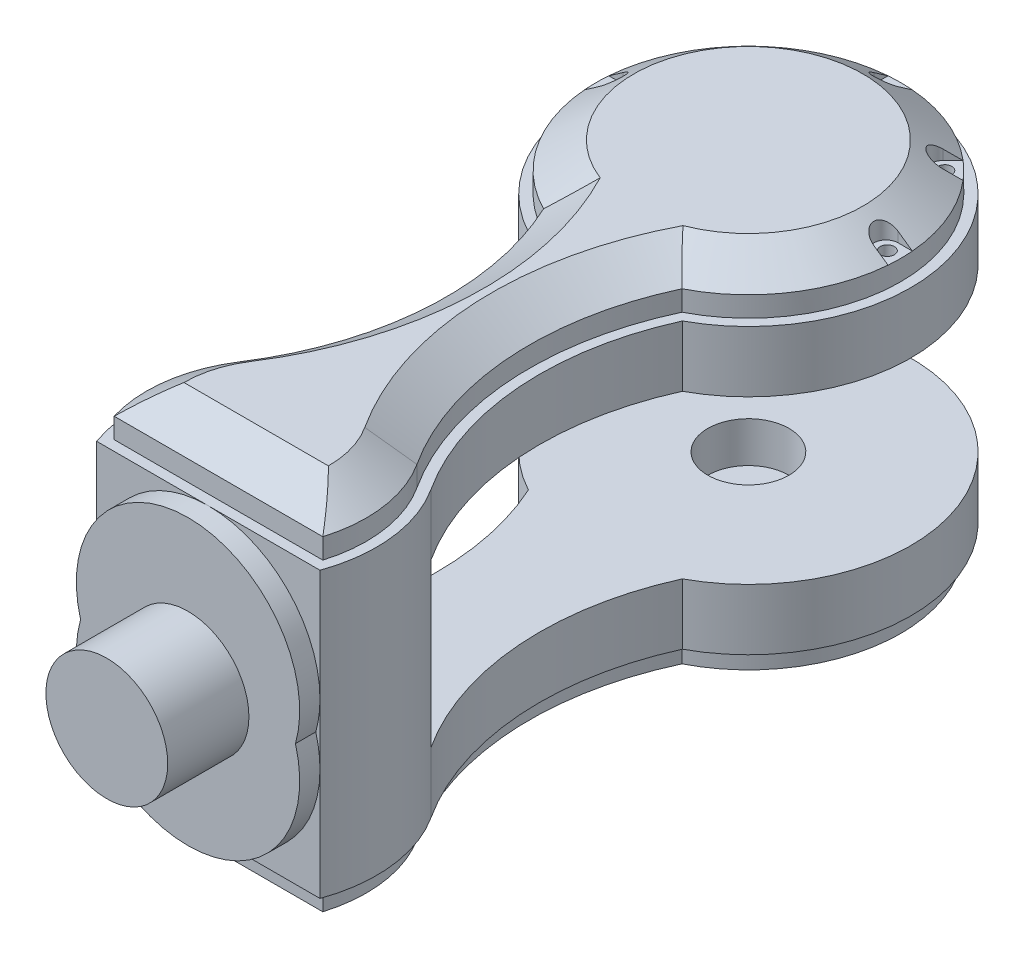
from build123d import *

# Parameters (mm, degrees)
SKETCH1_R                       = 27.5
BOSS_EXTRUDE1_DEPTH             = 5
BOSS_EXTRUDE2_DEPTH             = 15
BOSS_EXTRUDE3_DEPTH             = 1
BOSS_EXTRUDE4_DEPTH             = 4
BOSS_EXTRUDE5_DEPTH             = 6.5
BOSS_EXTRUDE5_DRAFT             = 55
CUT_EXTRUDE1_DEPTH              = 6.5
SKETCH13_R                      = 1.75
CUT_EXTRUDE8_DEPTH              = 5
CIRPATTERN1_COUNT               = 3
CIRPATTERN1_ANGLE               = 90
CIRPATTERN1_THE_OTHER_WAY_COUNT = 3
CIRPATTERN1_THE_OTHER_WAY_ANGLE = 90
BOSS_EXTRUDE6_DEPTH             = 40
SKETCH15_R                      = 15
BOSS_EXTRUDE7_DEPTH             = 20
SKETCH16_R                      = 10
CUT_EXTRUDE9_DEPTH              = 10
SCALE1_SCALE                    = 25.398779841


with BuildPart() as part:
    # Sketch1 → Boss-Extrude1 (new body)
    with BuildSketch(Plane.XY):
        Circle(SKETCH1_R)
    extrude(amount=BOSS_EXTRUDE1_DEPTH)



with BuildPart() as body_2:
    # Sketch3 → Boss-Extrude2 (new body)
    with BuildSketch(Plane(origin=(0, 27.5, 0), x_dir=(1, 0, 0), z_dir=(0, 1, 0))):
        with BuildLine():
            Line((-27.5, 0), (27.5, 0))
            ThreePointArc((27.5, 0), (29.34132241, 15.851086169), (23.954515433, 30.872061887))
            ThreePointArc((23.954515433, 30.872061887), (12.91820016, 63.687281567), (18.957742195, 97.777790943))
            ThreePointArc((18.957742195, 97.777790943), (0, 173), (-18.957742195, 97.777790943))
            ThreePointArc((-18.957742195, 97.777790943), (-12.91820016, 63.687281567), (-23.954515433, 30.872061887))
            ThreePointArc((-23.954515433, 30.872061887), (-29.34132241, 15.851086169), (-27.5, 0))
        make_face()
    extrude(amount=BOSS_EXTRUDE2_DEPTH)

    # Sketch5 → Boss-Extrude3 (add)
    with BuildSketch(Plane(origin=(0, 42.5, 0), x_dir=(1, 0, 0), z_dir=(0, 1, 0))):
        with BuildLine():
            Line((-25.693531989, 2.5), (25.693531989, 2.5))
            ThreePointArc((25.693531989, 2.5), (26.746761603, 16.429214372), (21.855612604, 29.513898821))
            ThreePointArc((21.855612604, 29.513898821), (10.394163023, 63.933295532), (17.042604151, 99.596412711))
            ThreePointArc((17.042604151, 99.596412711), (0, 170.5), (-17.042604151, 99.596412711))
            ThreePointArc((-17.042604151, 99.596412711), (-10.394163023, 63.933295532), (-21.855612604, 29.513898821))
            ThreePointArc((-21.855612604, 29.513898821), (-26.746761603, 16.429214372), (-25.693531989, 2.5))
        make_face()
    extrude(amount=BOSS_EXTRUDE3_DEPTH)

    # Sketch9 → Boss-Extrude4 (add)
    with BuildSketch(Plane(origin=(0, 43.5, 0), x_dir=(1, 0, 0), z_dir=(0, 1, 0))):
        with BuildLine():
            ThreePointArc((17.042604151, 99.596412711), (0, 170.5), (-17.042604151, 99.596412711))
            ThreePointArc((-17.042604151, 99.596412711), (-10.394163023, 63.933295532), (-21.855612604, 29.513898821))
            ThreePointArc((-21.855612604, 29.513898821), (-26.746761603, 16.429214372), (-25.693531989, 2.5))
            Line((-25.693531989, 2.5), (25.693531989, 2.5))
            ThreePointArc((25.693531989, 2.5), (26.746761603, 16.429214372), (21.855612604, 29.513898821))
            ThreePointArc((21.855612604, 29.513898821), (10.394163023, 63.933295532), (17.042604151, 99.596412711))
        make_face()
    extrude(amount=BOSS_EXTRUDE4_DEPTH)


with BuildPart() as boss_extrude5_tool:
    # Sketch10 → Boss-Extrude5 (with draft: the straight prism first)
    with BuildSketch(Plane(origin=(0, 47.5, 0), x_dir=(1, 0, 0), z_dir=(0, 1, 0))):
        with BuildLine():
            Line((-25.693531989, 2.5), (25.693531989, 2.5))
            ThreePointArc((25.693531989, 2.5), (26.746761603, 16.429214372), (21.855612604, 29.513898821))
            ThreePointArc((21.855612604, 29.513898821), (10.394163023, 63.933295532), (17.042604151, 99.596412711))
            ThreePointArc((17.042604151, 99.596412711), (0, 170.5), (-17.042604151, 99.596412711))
            ThreePointArc((-17.042604151, 99.596412711), (-10.394163023, 63.933295532), (-21.855612604, 29.513898821))
            ThreePointArc((-21.855612604, 29.513898821), (-26.746761603, 16.429214372), (-25.693531989, 2.5))
        make_face()
    extrude(amount=BOSS_EXTRUDE5_DEPTH)
    # Boss-Extrude5: the draft: its side faces are tilted about the plane it starts from
    boss_extrude5_sides = [boss_extrude5_tool.faces().sort_by_distance(p)[0] for p in [
        (0, 50.75, -2.5),
        (26.746761603, 50.75, -16.429214372),
        (10.394163023, 50.75, -63.933295532),
        (0, 50.75, -170.5),
        (-10.394163023, 50.75, -63.933295532),
        (-26.746761603, 50.75, -16.429214372),
    ]]
    draft(boss_extrude5_sides, Plane(origin=(0, 47.5, 0), x_dir=(1, 0, 0), z_dir=(0, 1, 0)), BOSS_EXTRUDE5_DRAFT)


with BuildPart() as body_2_1:
    add(body_2.part)

    # Boss-Extrude5: add boss_extrude5_tool
    add(boss_extrude5_tool.part)

    # Sketch11 → Cut-Extrude1 (cut)
    with BuildSketch(Plane(origin=(0, 54, 0), x_dir=(1, 0, 0), z_dir=(0, 1, 0))):
        with BuildLine():
            Line((-3, 172.88734135), (-3, 166.88734135))
            ThreePointArc((-3, 166.88734135), (0, 163.88734135), (3, 166.88734135))
            Line((3, 166.88734135), (3, 172.88734135))
            ThreePointArc((3, 172.88734135), (0, 173.88734135), (-3, 172.88734135))
        make_face()
    cut_extrude1 = extrude(amount=-CUT_EXTRUDE1_DEPTH, mode=Mode.SUBTRACT)

    # Sketch13 → Cut-Extrude8 (cut)
    with BuildSketch(Plane(origin=(0, 47.5, 0), x_dir=(1, 0, 0), z_dir=(0, 1, 0))):
        with Locations(Location((0, 167.193670675, 0), (0, 0, 270))):
            Circle(SKETCH13_R)
    cut_extrude8 = extrude(amount=-CUT_EXTRUDE8_DEPTH, mode=Mode.SUBTRACT)

    # CirPattern1: Cut-Extrude1, Cut-Extrude8 ×3 about axis
    cirpattern1_axis = Axis((0, 0, -133), (0, 1, 0))
    add([cut_extrude1.rotate(cirpattern1_axis, i * CIRPATTERN1_ANGLE / (CIRPATTERN1_COUNT - 1)) for i in range(1, CIRPATTERN1_COUNT)], mode=Mode.SUBTRACT)
    add([cut_extrude8.rotate(cirpattern1_axis, i * CIRPATTERN1_ANGLE / (CIRPATTERN1_COUNT - 1)) for i in range(1, CIRPATTERN1_COUNT)], mode=Mode.SUBTRACT)

    # CirPattern1 the other way: Cut-Extrude1, Cut-Extrude8 ×3 about axis
    cirpattern1_the_other_way_axis = Axis((0, 0, -133), (0, -1, 0))
    add([cut_extrude1.rotate(cirpattern1_the_other_way_axis, i * CIRPATTERN1_THE_OTHER_WAY_ANGLE / (CIRPATTERN1_THE_OTHER_WAY_COUNT - 1)) for i in range(1, CIRPATTERN1_THE_OTHER_WAY_COUNT)], mode=Mode.SUBTRACT)
    add([cut_extrude8.rotate(cirpattern1_the_other_way_axis, i * CIRPATTERN1_THE_OTHER_WAY_ANGLE / (CIRPATTERN1_THE_OTHER_WAY_COUNT - 1)) for i in range(1, CIRPATTERN1_THE_OTHER_WAY_COUNT)], mode=Mode.SUBTRACT)


with BuildPart() as part_1:
    add(part.part)

    add(body_2_1.part)  # Boss-Extrude6 merges body 2
    # Sketch14 → Boss-Extrude6 (add)
    with BuildSketch(Plane.XZ.offset(-27.5)):
        with BuildLine():
            Line((-23.954515433, -30.872061887), (23.954515433, -30.872061887))
            ThreePointArc((23.954515433, -30.872061887), (29.34132241, -15.851086169), (27.5, 0))
            Line((27.5, 0), (-27.5, 0))
            ThreePointArc((-27.5, 0), (-29.34132241, -15.851086169), (-23.954515433, -30.872061887))
        make_face()
    extrude(amount=BOSS_EXTRUDE6_DEPTH)

    # Mirror2: part across plane


with BuildPart() as part_2:
    add(part_1.part)
    add(part_1.part.mirror(Plane(origin=(0, 7.5, 0), x_dir=(0, 0, 1), z_dir=(0, -1, 0))))

    # Sketch15 → Boss-Extrude7 (add)
    with BuildSketch(Plane.XY.offset(5)):
        with Locations((0, 7.5)):
            Circle(SKETCH15_R)
    extrude(amount=BOSS_EXTRUDE7_DEPTH)

    # Sketch16 → Cut-Extrude9 (cut)
    with BuildSketch(Plane.XZ.offset(-27.5)):
        with Locations(Location((0, -133, 0), (0, 0, 270))):
            Circle(SKETCH16_R)
    cut_extrude9 = extrude(amount=-CUT_EXTRUDE9_DEPTH, mode=Mode.SUBTRACT)

    # Mirror6: Cut-Extrude9 across plane
    add(cut_extrude9.mirror(Plane(origin=(0, 7.5, 0), x_dir=(0, 0, 1), z_dir=(0, -1, 0))), mode=Mode.SUBTRACT)


with BuildPart() as part_3:
    # Scale1: scaled about (6.48e-07, 7.5, -76.560260818)
    add(part_2.part.scale(SCALE1_SCALE).moved(Location((-1.581e-05, -182.990848806, 1867.976948253))))


solid = part_3.part
